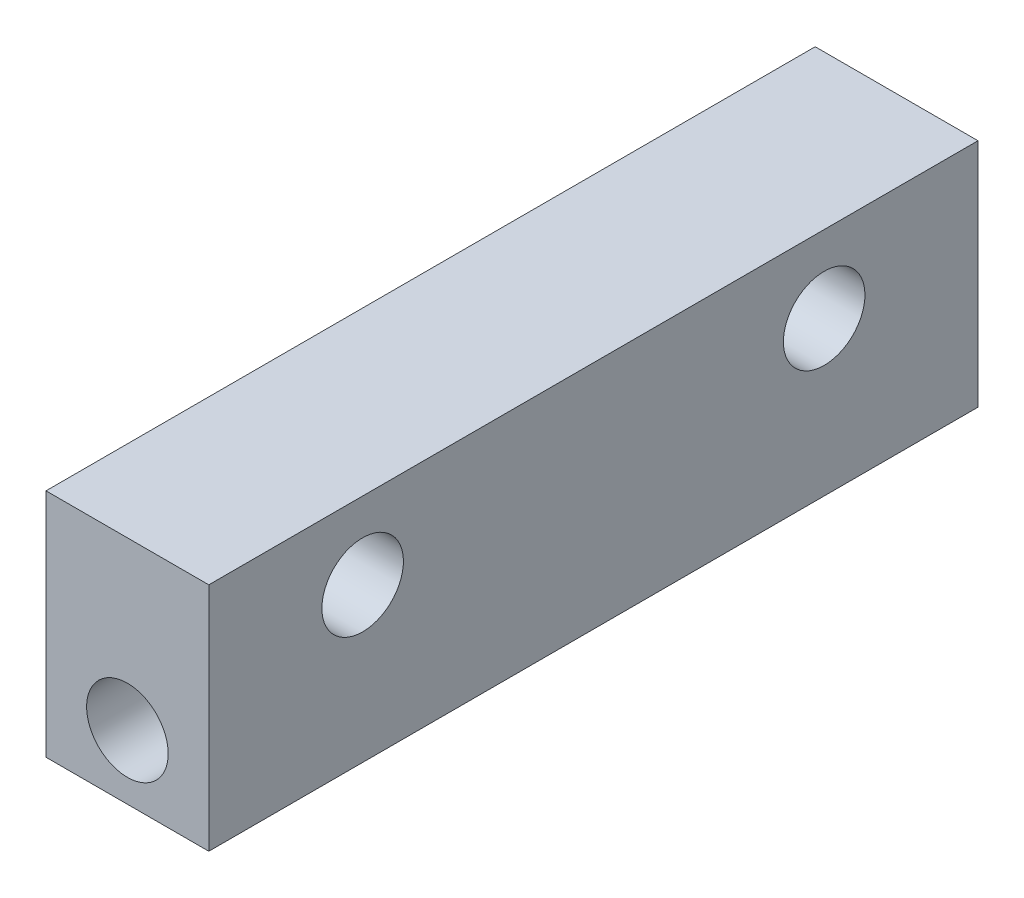
from build123d import *

# Parameters (mm, degrees)
SKETCH1_W           = 6.35
SKETCH1_H           = 9
SKETCH1_R           = 1.591
BOSS_EXTRUDE1_DEPTH = 30
SKETCH2_R           = 1.59
CUT_EXTRUDE1_DEPTH  = 30


with BuildPart() as part:
    # Sketch1 → Boss-Extrude1 (new body)
    with BuildSketch(Plane.XY):
        with Locations((3.175, -4.5)):
            Rectangle(SKETCH1_W, SKETCH1_H)
        with Locations((3.175, -6.5)):
            Circle(SKETCH1_R, mode=Mode.SUBTRACT)
    extrude(amount=BOSS_EXTRUDE1_DEPTH)

    # Sketch2 → Cut-Extrude1 (cut)
    with BuildSketch(Plane(origin=(0, 0, 0), x_dir=(0, 0, -1), z_dir=(1, 0, 0))):
        with Locations((-24, -3)):
            Circle(SKETCH2_R)
        with Locations((-6, -3)):
            Circle(SKETCH2_R)
    extrude(amount=CUT_EXTRUDE1_DEPTH, mode=Mode.SUBTRACT)


solid = part.part
